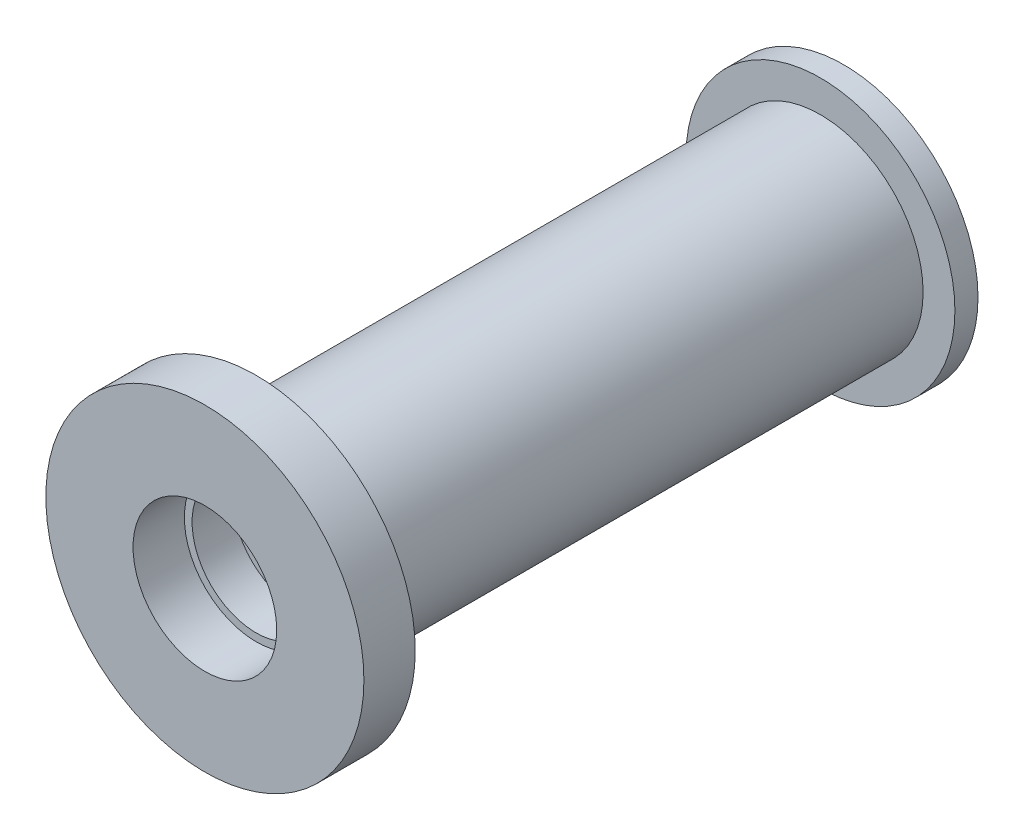
from build123d import *

# Parameters (mm, degrees)
S01_CORD_EYE_LINER_R                 = 2
S01_CORD_EYE_LINER_R_2               = 1.1
F_01_CORD_EYE_LINER_DEPTH            = 11
F_02_START                           = -0.45
S02_SWAGED_REAR_RETENTION_LIP_R      = 2.62
S02_SWAGED_REAR_RETENTION_LIP_R_2    = 1.1
F_02_SWAGED_REAR_RETENTION_LIP_DEPTH = 0.45
F_03_START                           = 11
S03_MOUTH_FLANGE_R                   = 3.1
S03_MOUTH_FLANGE_R_2                 = 1.4
F_03_MOUTH_FLANGE_DEPTH              = 1
F_04_START                           = 10.2
S04_INLET_RELIEF_R                   = 1.25
F_04_INLET_RELIEF_DEPTH              = 0.9


with BuildPart() as part:
    # S01 - Cord eye liner → 01 - Cord eye liner (new body)
    with BuildSketch(Plane.XY):
        Circle(S01_CORD_EYE_LINER_R)
        Circle(S01_CORD_EYE_LINER_R_2, mode=Mode.SUBTRACT)
    extrude(amount=F_01_CORD_EYE_LINER_DEPTH)

    # S02 - Swaged rear retention lip → 02 - Swaged rear retention lip (add)
    with BuildSketch(Plane.XY.offset(F_02_START)):
        Circle(S02_SWAGED_REAR_RETENTION_LIP_R)
        Circle(S02_SWAGED_REAR_RETENTION_LIP_R_2, mode=Mode.SUBTRACT)
    extrude(amount=F_02_SWAGED_REAR_RETENTION_LIP_DEPTH)

    # S03 - Mouth flange → 03 - Mouth flange (add)
    with BuildSketch(Plane.XY.offset(F_03_START)):
        Circle(S03_MOUTH_FLANGE_R)
        Circle(S03_MOUTH_FLANGE_R_2, mode=Mode.SUBTRACT)
    extrude(amount=F_03_MOUTH_FLANGE_DEPTH)

    # S04 - Inlet relief → 04 - Inlet relief (cut)
    with BuildSketch(Plane.XY.offset(F_04_START)):
        Circle(S04_INLET_RELIEF_R)
    extrude(amount=F_04_INLET_RELIEF_DEPTH, mode=Mode.SUBTRACT)


solid = part.part
